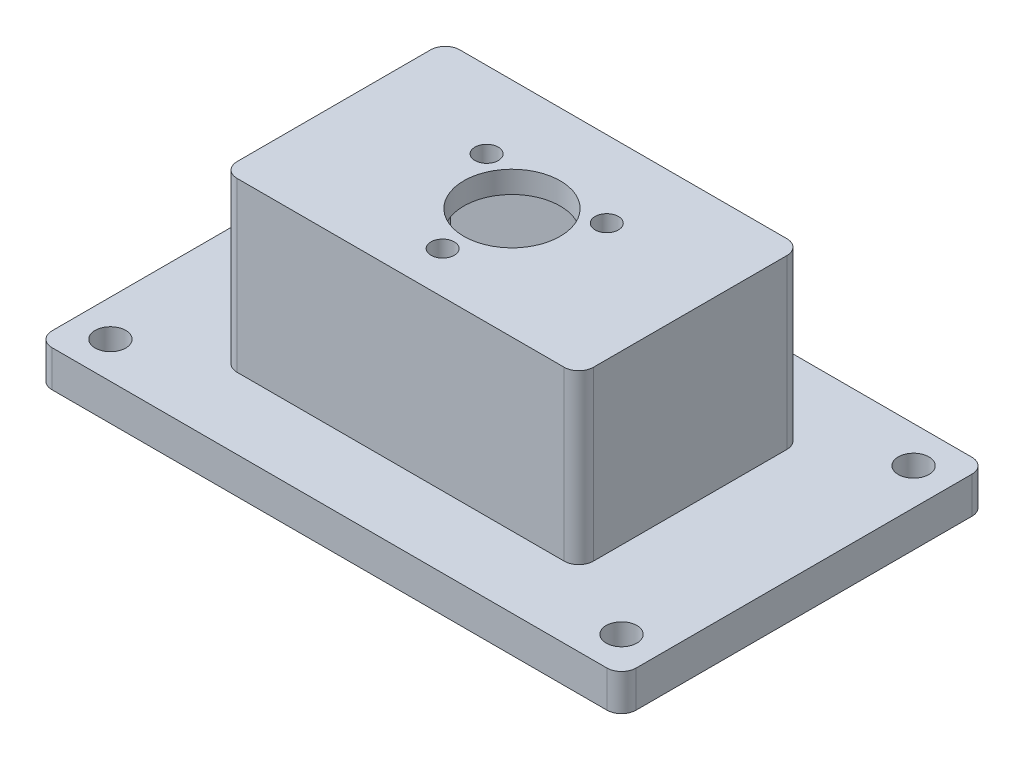
from build123d import *

# Parameters (mm, degrees)
SKETCH_1_W          = 80
SKETCH_1_H          = 50
SKETCH_1_R          = 2.1
SKETCH_1_W_2        = 44.8
SKETCH_1_H_2        = 28
EXTRUDE_1_DEPTH     = 5
FILLET_1_R          = 2
SKETCH_2_W          = 48.8
SKETCH_2_H          = 30.5
SKETCH_2_W_2        = 44.8
SKETCH_2_H_2        = 28
EXTRUDE_2_DEPTH     = 20
SKETCH_3_W          = 48.8
SKETCH_3_H          = 30.5
SKETCH_3_R          = 6.6
EXTRUDE_3_DEPTH     = 3
FILLET_2_R          = 2
SKETCH_4_R          = 1.6
CUT_EXTRUDE_1_DEPTH = 55.854352608


with BuildPart() as part:
    # 草图1 → 凸台-拉伸1 (new body)
    with BuildSketch(Plane(origin=(0, 0, 0), x_dir=(1, 0, 0), z_dir=(0, 1, 0))):
        Rectangle(SKETCH_1_W, SKETCH_1_H)
        with Locations(Location((35, 20, 0), (0, 0, 270))):
            Circle(SKETCH_1_R, mode=Mode.SUBTRACT)
        with Locations(Location((35, -20, 0), (0, 0, 90))):
            Circle(SKETCH_1_R, mode=Mode.SUBTRACT)
        with Locations(Location((-35, -20, 0), (0, 0, 270))):
            Circle(SKETCH_1_R, mode=Mode.SUBTRACT)
        with Locations(Location((-35, 20, 0), (0, 0, 90))):
            Circle(SKETCH_1_R, mode=Mode.SUBTRACT)
        Rectangle(SKETCH_1_W_2, SKETCH_1_H_2, mode=Mode.SUBTRACT)
    extrude(amount=EXTRUDE_1_DEPTH)

    # 圆角1
    fillet_1_edges = [part.edges().sort_by_distance(p)[0] for p in [
        (40, 2.5, 25),
        (-40, 2.5, 25),
        (-40, 2.5, -25),
        (40, 2.5, -25),
    ]]
    fillet(fillet_1_edges, radius=FILLET_1_R)

    # 草图2 → 凸台-拉伸2 (add)
    with BuildSketch(Plane(origin=(0, 5, 0), x_dir=(1, 0, 0), z_dir=(0, 1, 0))):
        Rectangle(SKETCH_2_W, SKETCH_2_H)
        Rectangle(SKETCH_2_W_2, SKETCH_2_H_2, mode=Mode.SUBTRACT)
    extrude(amount=EXTRUDE_2_DEPTH)

    # 草图3 → 凸台-拉伸3 (add)
    with BuildSketch(Plane(origin=(0, 25, 0), x_dir=(1, 0, 0), z_dir=(0, 1, 0))):
        Rectangle(SKETCH_3_W, SKETCH_3_H)
        with Locations(Location((0, 0, 0), (0, 0, 270))):
            Circle(SKETCH_3_R, mode=Mode.SUBTRACT)
    extrude(amount=EXTRUDE_3_DEPTH)

    # 圆角2
    fillet_2_edges = [part.edges().sort_by_distance(p)[0] for p in [
        (24.4, 16.5, 15.25),
        (24.4, 16.5, -15.25),
        (-24.4, 16.5, -15.25),
        (-24.4, 16.5, 15.25),
    ]]
    fillet(fillet_2_edges, radius=FILLET_2_R)

    # 草图4 → 切除-拉伸1 (cut, through all)
    with BuildSketch(Plane(origin=(0, 28, 0), x_dir=(1, 0, 0), z_dir=(0, 1, 0))):
        with Locations(Location((0, -9.5, 0), (0, 0, 270))):
            Circle(SKETCH_4_R)
        with Locations(Location((-8.227241336, 4.75, 0), (0, 0, 270))):
            Circle(SKETCH_4_R)
        with Locations(Location((8.227241336, 4.75, 0), (0, 0, 270))):
            Circle(SKETCH_4_R)
    extrude(amount=-CUT_EXTRUDE_1_DEPTH, mode=Mode.SUBTRACT)


solid = part.part
